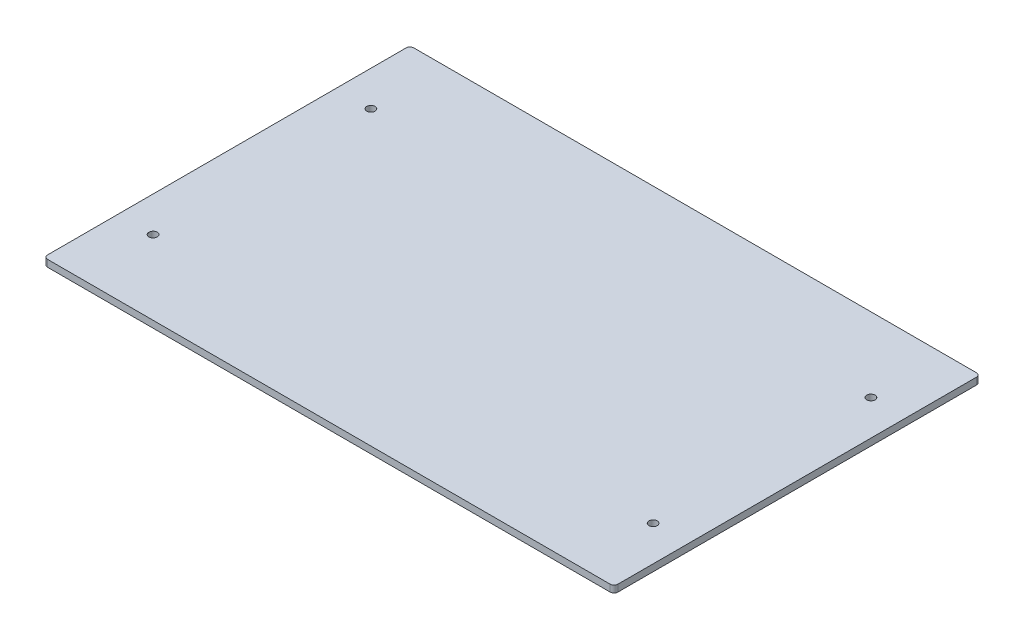
from build123d import *

# Parameters (mm, degrees)
SKETCH1_W           = 463.55
SKETCH1_H           = 297.688
SKETCH1_R           = 3.3782
BOSS_EXTRUDE1_DEPTH = 5.588
FILLET1_R           = 3.175


with BuildPart() as part:
    # Sketch1 → Boss-Extrude1 (new body)
    with BuildSketch(Plane(origin=(0, 0, 0), x_dir=(1, 0, 0), z_dir=(0, 1, 0))):
        with Locations((231.775, 148.844)):
            Rectangle(SKETCH1_W, SKETCH1_H)
        with Locations(Location((28.575, 60.325, 0), (0, 0, 270))):
            Circle(SKETCH1_R, mode=Mode.SUBTRACT)
        with Locations(Location((28.575, 237.363, 0), (0, 0, 270))):
            Circle(SKETCH1_R, mode=Mode.SUBTRACT)
        with Locations(Location((434.975, 237.363, 0), (0, 0, 90))):
            Circle(SKETCH1_R, mode=Mode.SUBTRACT)
        with Locations(Location((434.975, 60.325, 0), (0, 0, 90))):
            Circle(SKETCH1_R, mode=Mode.SUBTRACT)
    extrude(amount=BOSS_EXTRUDE1_DEPTH)

    # Fillet1
    fillet1_edges = [part.edges().sort_by_distance(p)[0] for p in [
        (0, 2.794, -297.688),
        (463.55, 2.794, -297.688),
        (463.55, 2.794, 0),
        (0, 2.794, 0),
    ]]
    fillet(fillet1_edges, radius=FILLET1_R)


solid = part.part
